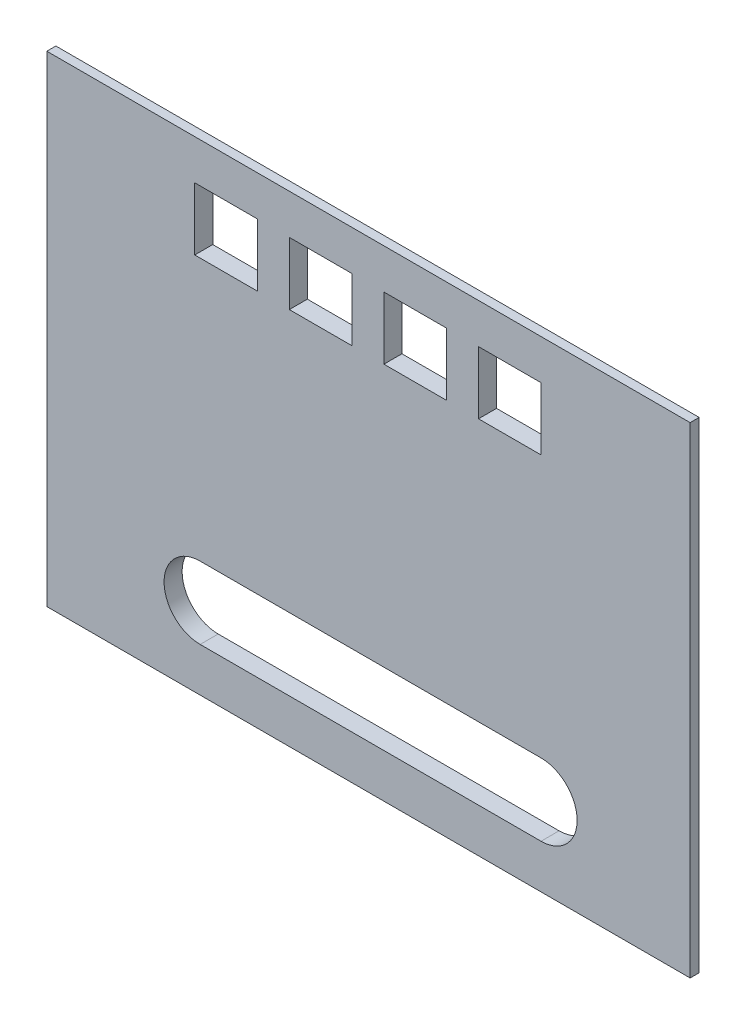
from build123d import *

# Parameters (mm, degrees)
SKETCH_1_W          = 101
SKETCH_1_H          = 74
EXTRUDE_1_DEPTH     = 3
EXTRUDE_START       = 1.5
SKETCH_2_W          = 107
SKETCH_2_H          = 80
EXTRUDE_2_DEPTH     = 1.5
SKETCH_3_W          = 10.4
SKETCH_3_H          = 10.4
CUT_EXTRUDE_1_DEPTH = 5


with BuildPart() as part:
    # Эскиз1 → Бобышка-Вытянуть1 (new body)
    with BuildSketch(Plane.XY):
        with Locations((53.5, 40)):
            Rectangle(SKETCH_1_W, SKETCH_1_H)
    extrude(amount=EXTRUDE_1_DEPTH)

    # Эскиз2 → Бобышка-Вытянуть2 (add)
    with BuildSketch(Plane.XY.offset(EXTRUDE_START)):
        with Locations((53.5, 40)):
            Rectangle(SKETCH_2_W, SKETCH_2_H)
    extrude(amount=EXTRUDE_2_DEPTH)

    # Эскиз3 → Вырез-Вытянуть1 (cut)
    with BuildSketch(Plane.XY.offset(3)):
        with Locations((29.8, 68.15)):
            Rectangle(SKETCH_3_W, SKETCH_3_H)
        with Locations((45.533, 68.15)):
            Rectangle(SKETCH_3_W, SKETCH_3_H)
        with Locations((61.267, 68.15)):
            Rectangle(SKETCH_3_W, SKETCH_3_H)
        with Locations((77, 68.15)):
            Rectangle(SKETCH_3_W, SKETCH_3_H)
        with BuildLine():
            Line((25.5, 19.3), (82.2, 19.3))
            ThreePointArc((82.2, 19.3), (88.2, 13.3), (82.2, 7.3))
            Line((82.2, 7.3), (25.5, 7.3))
            ThreePointArc((25.5, 7.3), (19.5, 13.3), (25.5, 19.3))
        make_face()
    extrude(amount=-CUT_EXTRUDE_1_DEPTH, mode=Mode.SUBTRACT)


solid = part.part
